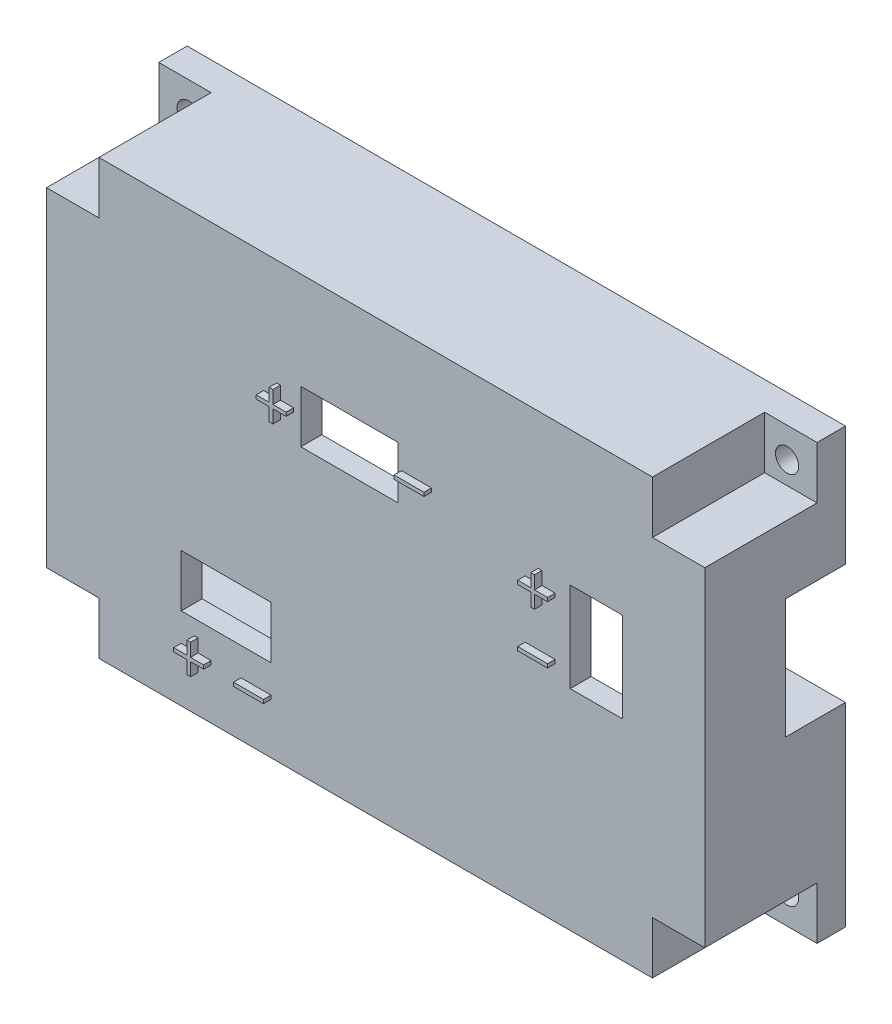
from build123d import *

# Parameters (mm, degrees)
SKETCH_1_W           = 88
SKETCH_1_H           = 58
EXTRUDE_1_DEPTH      = 18.8
SKETCH_2_W           = 7
SKETCH_2_H           = 7
CUT_EXTRUDE_1_DEPTH  = 15
SKETCH_3_R           = 1.55
CUT_EXTRUDE_2_DEPTH  = 3
SKETCH_4_W           = 72
SKETCH_4_H           = 42
CUT_EXTRUDE_6_DEPTH  = 16
SKETCH_6_W           = 16
SKETCH_6_H           = 8
CUT_EXTRUDE_7_DEPTH  = 8
CUT_EXTRUDE_11_REACH = 109.058
SKETCH_7_W           = 12
SKETCH_7_H           = 7
SKETCH_7_W_2         = 7
SKETCH_7_H_2         = 12
SKETCH_7_W_3         = 13
CUT_EXTRUDE_13_REACH = 109.058
SKETCH_10_W          = 8
SKETCH_10_H          = 16
CUT_EXTRUDE_14_REACH = 108.457
SKETCH_3_2_R         = 1.55
SKETCH_14_W          = 4
SKETCH_14_H          = 0.5
EXTRUDE_3_DEPTH      = 1
SKETCH_16_W          = 4
SKETCH_16_H          = 0.5
EXTRUDE_5_DEPTH      = 1
SKETCH_18_W          = 4
SKETCH_18_H          = 0.5
EXTRUDE_6_DEPTH      = 1


with BuildPart() as part:
    # 草图1 → 凸台-拉伸1 (new body)
    with BuildSketch(Plane.XY):
        with Locations((44, 29)):
            Rectangle(SKETCH_1_W, SKETCH_1_H)
    extrude(amount=EXTRUDE_1_DEPTH)

    # 草图2 → 切除-拉伸1 (cut)
    with BuildSketch(Plane.XY.offset(18.8)):
        with Locations((3.5, 54.5)):
            Rectangle(SKETCH_2_W, SKETCH_2_H)
        with Locations((3.5, 3.5)):
            Rectangle(SKETCH_2_W, SKETCH_2_H)
        with Locations((84.5, 3.5)):
            Rectangle(SKETCH_2_W, SKETCH_2_H)
        with Locations((84.5, 54.5)):
            Rectangle(SKETCH_2_W, SKETCH_2_H)
    extrude(amount=-CUT_EXTRUDE_1_DEPTH, mode=Mode.SUBTRACT)

    # 草图3 → 切除-拉伸2 (cut)
    with BuildSketch(Plane.XY.offset(3.8)):
        with Locations((4, 54)):
            Circle(SKETCH_3_R)
        with Locations((4, 4)):
            Circle(SKETCH_3_R)
        with Locations((84, 4)):
            Circle(SKETCH_3_R)
        with Locations((84, 54)):
            Circle(SKETCH_3_R)
    extrude(amount=-CUT_EXTRUDE_2_DEPTH, mode=Mode.SUBTRACT)

    # 草图4 → 切除-拉伸6 (cut)
    with BuildSketch(Plane(origin=(0, 0, 0), x_dir=(-1, 0, 0), z_dir=(0, 0, -1))):
        with Locations((-44, 29)):
            Rectangle(SKETCH_4_W, SKETCH_4_H)
    extrude(amount=-CUT_EXTRUDE_6_DEPTH, mode=Mode.SUBTRACT)

    # 草图6 → 切除-拉伸7 (cut)
    with BuildSketch(Plane.XZ):
        with Locations((24, 4)):
            Rectangle(SKETCH_6_W, SKETCH_6_H)
    extrude(amount=-CUT_EXTRUDE_7_DEPTH, mode=Mode.SUBTRACT)

    # 草图7 → 切除-拉伸11 (cut, up to next)
    with BuildSketch(Plane.XY.offset(18.8), mode=Mode.PRIVATE) as cut_extrude_11_sk1:
        with Locations((24, 14.5)):
            Rectangle(SKETCH_7_W, SKETCH_7_H)
    cut_extrude_11_tool1 = extrude(cut_extrude_11_sk1.sketch, amount=-CUT_EXTRUDE_11_REACH, mode=Mode.PRIVATE) & part.part
    # 草图7 → 切除-拉伸11 (cut, up to next)
    with BuildSketch(Plane.XY.offset(18.8), mode=Mode.PRIVATE) as cut_extrude_11_sk2:
        with Locations((73.5, 34)):
            Rectangle(SKETCH_7_W_2, SKETCH_7_H_2)
    cut_extrude_11_tool2 = extrude(cut_extrude_11_sk2.sketch, amount=-CUT_EXTRUDE_11_REACH, mode=Mode.PRIVATE) & part.part
    # 草图7 → 切除-拉伸11 (cut, up to next)
    with BuildSketch(Plane.XY.offset(18.8), mode=Mode.PRIVATE) as cut_extrude_11_sk3:
        with Locations((40.5, 41.5)):
            Rectangle(SKETCH_7_W_3, SKETCH_7_H)
    cut_extrude_11_tool3 = extrude(cut_extrude_11_sk3.sketch, amount=-CUT_EXTRUDE_11_REACH, mode=Mode.PRIVATE) & part.part
    add(cut_extrude_11_tool1.solids().sort_by_distance((24, 14.5, 18.8))[0], mode=Mode.SUBTRACT)
    add(cut_extrude_11_tool2.solids().sort_by_distance((73.5, 34, 18.8))[0], mode=Mode.SUBTRACT)
    add(cut_extrude_11_tool3.solids().sort_by_distance((40.5, 41.5, 18.8))[0], mode=Mode.SUBTRACT)

    # 草图10 → 切除-拉伸13 (cut, up to next)
    with BuildSketch(Plane(origin=(88, 0, 0), x_dir=(0, 0, -1), z_dir=(1, 0, 0)), mode=Mode.PRIVATE) as cut_extrude_13_sk1:
        with Locations((-4, 34)):
            Rectangle(SKETCH_10_W, SKETCH_10_H)
    cut_extrude_13_tool1 = extrude(cut_extrude_13_sk1.sketch, amount=-CUT_EXTRUDE_13_REACH, mode=Mode.PRIVATE) & part.part
    add(cut_extrude_13_tool1.solids().sort_by_distance((88, 34, 4))[0], mode=Mode.SUBTRACT)

    # 草图3<2> → 切除-拉伸14 (cut, up to next)
    with BuildSketch(Plane.XY.offset(3.8), mode=Mode.PRIVATE) as cut_extrude_14_sk1:
        with Locations((4, 54)):
            Circle(SKETCH_3_2_R)
    cut_extrude_14_tool1 = extrude(cut_extrude_14_sk1.sketch, amount=-CUT_EXTRUDE_14_REACH, mode=Mode.PRIVATE) & part.part
    # 草图3<2> → 切除-拉伸14 (cut, up to next)
    with BuildSketch(Plane.XY.offset(3.8), mode=Mode.PRIVATE) as cut_extrude_14_sk2:
        with Locations((4, 4)):
            Circle(SKETCH_3_2_R)
    cut_extrude_14_tool2 = extrude(cut_extrude_14_sk2.sketch, amount=-CUT_EXTRUDE_14_REACH, mode=Mode.PRIVATE) & part.part
    # 草图3<2> → 切除-拉伸14 (cut, up to next)
    with BuildSketch(Plane.XY.offset(3.8), mode=Mode.PRIVATE) as cut_extrude_14_sk3:
        with Locations((84, 4)):
            Circle(SKETCH_3_2_R)
    cut_extrude_14_tool3 = extrude(cut_extrude_14_sk3.sketch, amount=-CUT_EXTRUDE_14_REACH, mode=Mode.PRIVATE) & part.part
    # 草图3<2> → 切除-拉伸14 (cut, up to next)
    with BuildSketch(Plane.XY.offset(3.8), mode=Mode.PRIVATE) as cut_extrude_14_sk4:
        with Locations((84, 54)):
            Circle(SKETCH_3_2_R)
    cut_extrude_14_tool4 = extrude(cut_extrude_14_sk4.sketch, amount=-CUT_EXTRUDE_14_REACH, mode=Mode.PRIVATE) & part.part
    add(cut_extrude_14_tool1.solids().sort_by_distance((4, 54, 3.8))[0], mode=Mode.SUBTRACT)
    add(cut_extrude_14_tool2.solids().sort_by_distance((4, 4, 3.8))[0], mode=Mode.SUBTRACT)
    add(cut_extrude_14_tool3.solids().sort_by_distance((84, 4, 3.8))[0], mode=Mode.SUBTRACT)
    add(cut_extrude_14_tool4.solids().sort_by_distance((84, 54, 3.8))[0], mode=Mode.SUBTRACT)

    # 草图14 → 凸台-拉伸3 (add)
    with BuildSketch(Plane.XY.offset(18.8)):
        Polygon((19.75, 7.25), (18, 7.25), (18, 6.75), (19.75, 6.75), (19.75, 5), (20.25, 5), (20.25, 6.75), (22, 6.75), (22, 7.25), (20.25, 7.25), (20.25, 9), (19.75, 9), align=None)
        with Locations((28, 7)):
            Rectangle(SKETCH_14_W, SKETCH_14_H)
    extrude(amount=EXTRUDE_3_DEPTH)

    # 草图16 → 凸台-拉伸5 (add)
    with BuildSketch(Plane.XY.offset(18.8)):
        Polygon((65.732583839, 38.050395287), (63.982583839, 38.050395287), (63.982583839, 37.550395287), (65.732583839, 37.550395287), (65.732583839, 35.800395287), (66.232583839, 35.800395287), (66.232583839, 37.550395287), (67.982583839, 37.550395287), (67.982583839, 38.050395287), (66.232583839, 38.050395287), (66.232583839, 39.800395287), (65.732583839, 39.800395287), align=None)
        with Locations((65.982583839, 30.12335271)):
            Rectangle(SKETCH_16_W, SKETCH_16_H)
    extrude(amount=EXTRUDE_5_DEPTH)

    # 草图18 → 凸台-拉伸6 (add)
    with BuildSketch(Plane.XY.offset(18.8)):
        Polygon((30.770756215, 42.025617215), (29.020756215, 42.025617215), (29.020756215, 41.525617215), (30.770756215, 41.525617215), (30.770756215, 39.775617215), (31.270756215, 39.775617215), (31.270756215, 41.525617215), (33.020756215, 41.525617215), (33.020756215, 42.025617215), (31.270756215, 42.025617215), (31.270756215, 43.775617215), (30.770756215, 43.775617215), align=None)
        with Locations((49.451487349, 41.714982736)):
            Rectangle(SKETCH_18_W, SKETCH_18_H)
    extrude(amount=EXTRUDE_6_DEPTH)


solid = part.part
